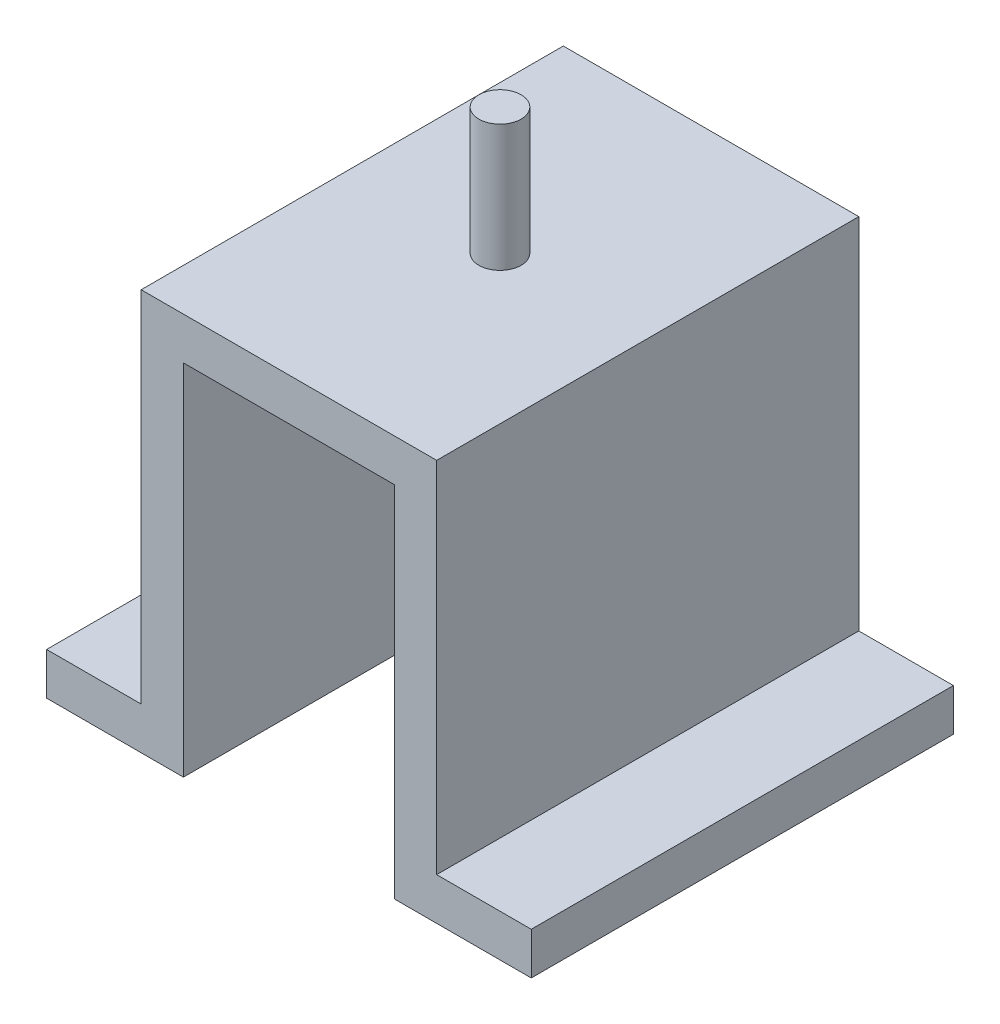
from build123d import *

# Parameters (mm, degrees)
BOSS_EXTRUDE1_DEPTH   = 100
BOSS_EXTRUDE1_2_DEPTH = 100
SKETCH2_W             = 70
SKETCH2_H             = 100
BOSS_EXTRUDE2_DEPTH   = 10
SKETCH3_R             = 5
BOSS_EXTRUDE3_DEPTH   = 30


with BuildPart() as part:
    # Sketch1 → Boss-Extrude1 (new body)
    with BuildSketch(Plane.XY):
        Polygon((-57.404010399, -45.485546177), (-25, -45.485546177), (-25, 39.514453823), (-35, 39.514453823), (-35, -35.485546177), (-57.404010399, -35.485546177), align=None)
    extrude(amount=BOSS_EXTRUDE1_DEPTH)



with BuildPart() as body_2:
    # Sketch1 → Boss-Extrude1 2 (new body)
    with BuildSketch(Plane.XY):
        Polygon((25, 39.514453823), (35, 39.514453823), (35, -35.485546177), (57.404010399, -35.485546177), (57.404010399, -45.485546177), (25, -45.485546177), align=None)
    extrude(amount=BOSS_EXTRUDE1_2_DEPTH)


with BuildPart() as part_1:
    add(part.part)

    add(body_2.part)  # Boss-Extrude2 merges body 2
    # Sketch2 → Boss-Extrude2 (add)
    with BuildSketch(Plane(origin=(0, 39.514453823, 0), x_dir=(1, 0, 0), z_dir=(0, 1, 0))):
        with Locations((0, -50)):
            Rectangle(SKETCH2_W, SKETCH2_H)
    extrude(amount=BOSS_EXTRUDE2_DEPTH)

    # Sketch3 → Boss-Extrude3 (add)
    with BuildSketch(Plane(origin=(0, 49.514453823, 0), x_dir=(1, 0, 0), z_dir=(0, 1, 0))):
        with Locations(Location((0, -50, 0), (0, 0, 180))):
            Circle(SKETCH3_R)
    extrude(amount=BOSS_EXTRUDE3_DEPTH)


solid = part_1.part
